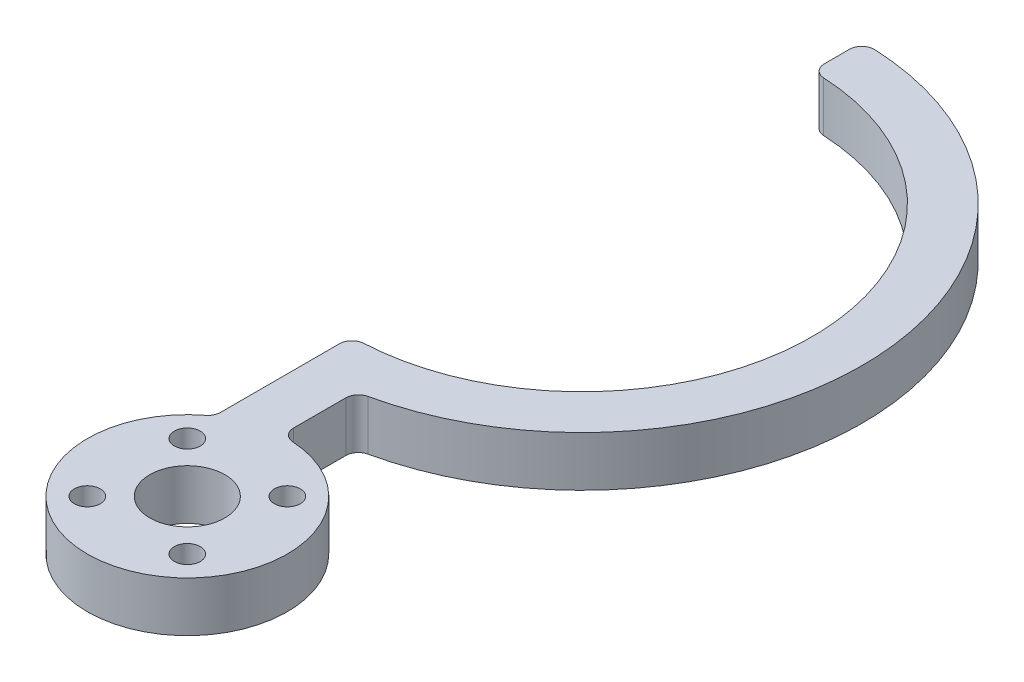
from build123d import *

# Parameters (mm, degrees)
SKETCH1_R           = 2.075
SKETCH1_R_2         = 6.003208263
BOSS_EXTRUDE2_DEPTH = 8
FILLET1_R           = 2


with BuildPart() as part:
    # Sketch1 → Boss-Extrude2 (new body)
    with BuildSketch(Plane(origin=(0, 0, 0), x_dir=(1, 0, 0), z_dir=(0, 1, 0))):
        with BuildLine():
            Line((0, 44.83), (0, 36.83))
            ThreePointArc((0, 36.83), (36.83, 0), (0, -36.83))
            Line((0, -36.83), (0, -46.83))
            Line((0, -46.83), (0, -58.83))
            ThreePointArc((0, -58.83), (14.116701064, -87.229775601), (8, -56.110417137))
            Line((8, -56.110417137), (8, -44.110417137))
            ThreePointArc((8, -44.110417137), (44.649741882, 4.016148637), (0, 44.83))
        make_face()
        with Locations(Location((0.96696537, -64.081170969, 0), (0, 0, 270))):
            Circle(SKETCH1_R, mode=Mode.SUBTRACT)
        with Locations(Location((16.96696537, -64.081170969, 0), (0, 0, 270))):
            Circle(SKETCH1_R, mode=Mode.SUBTRACT)
        with Locations(Location((16.96696537, -80.081170969, 0), (0, 0, 270))):
            Circle(SKETCH1_R, mode=Mode.SUBTRACT)
        with Locations(Location((0.96696537, -80.081170969, 0), (0, 0, 270))):
            Circle(SKETCH1_R, mode=Mode.SUBTRACT)
        with Locations(Location((8.96696537, -72.081170969, 0), (0, 0, 270))):
            Circle(SKETCH1_R_2, mode=Mode.SUBTRACT)
    extrude(amount=BOSS_EXTRUDE2_DEPTH)

    # Fillet1
    fillet1_edges = [part.edges().sort_by_distance(p)[0] for p in [
        (0, 4, 58.83),
        (0, 4, 36.83),
        (0, 4, -36.83),
        (0, 4, -44.83),
        (8, 4, 44.110417137),
        (8, 4, 56.110417137),
    ]]
    fillet(fillet1_edges, radius=FILLET1_R)


solid = part.part
